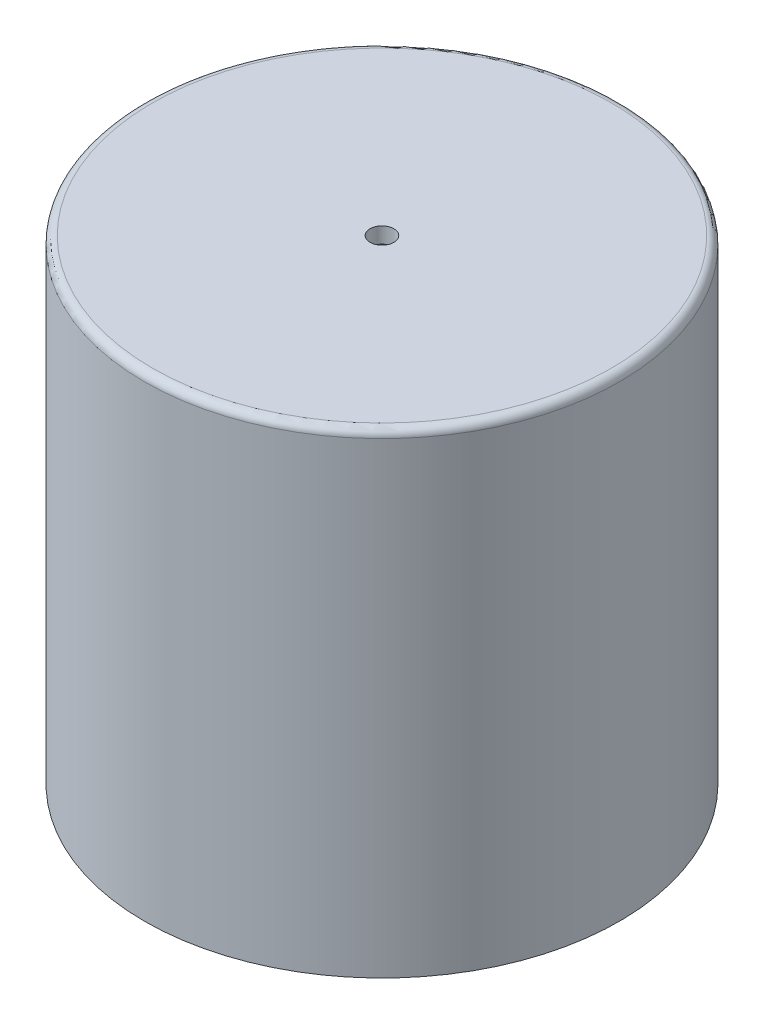
from build123d import *

# Parameters (mm, degrees)
SKETCH1_R           = 30
BOSS_EXTRUDE1_DEPTH = 60
SKETCH2_R           = 28.4
CUT_EXTRUDE1_DEPTH  = 58
SKETCH3_R           = 1.5
CUT_EXTRUDE2_DEPTH  = 2
FILLET2_R           = 1
FILLET3_R           = 1


with BuildPart() as part:
    # Sketch1 → Boss-Extrude1 (new body)
    with BuildSketch(Plane(origin=(0, 0, 0), x_dir=(1, 0, 0), z_dir=(0, 1, 0))):
        with Locations(Location((0, 0, 0), (0, 0, 270))):
            Circle(SKETCH1_R)
    extrude(amount=BOSS_EXTRUDE1_DEPTH)

    # Sketch2 → Cut-Extrude1 (cut)
    with BuildSketch(Plane(origin=(0, 0, 0), x_dir=(-1, 0, 0), z_dir=(0, -1, 0))):
        with Locations(Location((0, 0, 0), (0, 0, 90))):
            Circle(SKETCH2_R)
    extrude(amount=-CUT_EXTRUDE1_DEPTH, mode=Mode.SUBTRACT)

    # Sketch3 → Cut-Extrude2 (cut)
    with BuildSketch(Plane(origin=(0, 60, 0), x_dir=(1, 0, 0), z_dir=(0, 1, 0))):
        with Locations(Location((0, 0, 0), (0, 0, 270))):
            Circle(SKETCH3_R)
    extrude(amount=-CUT_EXTRUDE2_DEPTH, mode=Mode.SUBTRACT)

    # Fillet2
    fillet2_edges = [part.edges().sort_by_distance(p)[0] for p in [
        (0, 58, 28.4),
    ]]
    fillet(fillet2_edges, radius=FILLET2_R)

    # Fillet3
    fillet3_edges = [part.edges().sort_by_distance(p)[0] for p in [
        (0, 60, -30),
    ]]
    fillet(fillet3_edges, radius=FILLET3_R)


solid = part.part
